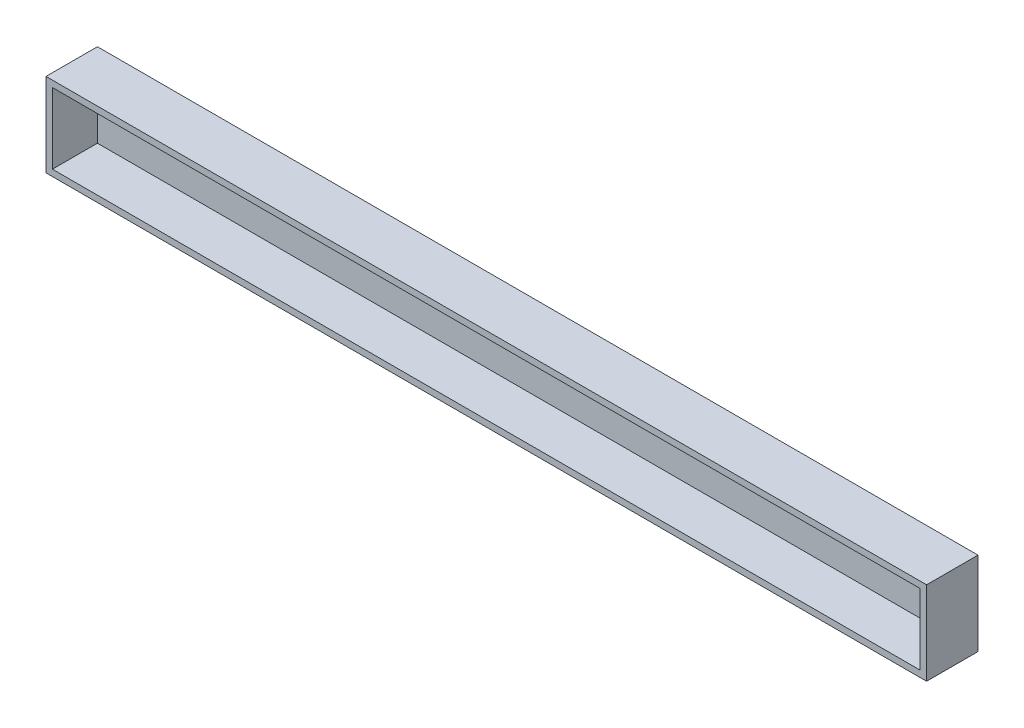
from build123d import *

# Parameters (mm, degrees)
SKETCH1_W     = 137
SKETCH1_H     = 13
SKETCH1_W_2   = 135
SKETCH1_H_2   = 11
PROFILE_DEPTH = 8
SKETCH2_W     = 135
SKETCH2_H     = 11
BACK_DEPTH    = 1


with BuildPart() as part:
    # Sketch1 → Profile (new body)
    with BuildSketch(Plane.XY):
        with Locations((68.5, 6.5)):
            Rectangle(SKETCH1_W, SKETCH1_H)
        with Locations((68.5, 6.5)):
            Rectangle(SKETCH1_W_2, SKETCH1_H_2, mode=Mode.SUBTRACT)
    extrude(amount=PROFILE_DEPTH)

    # Sketch2 → Back (add)
    with BuildSketch(Plane.XY):
        with Locations((68.5, 6.5)):
            Rectangle(SKETCH2_W, SKETCH2_H)
    extrude(amount=BACK_DEPTH)


solid = part.part
